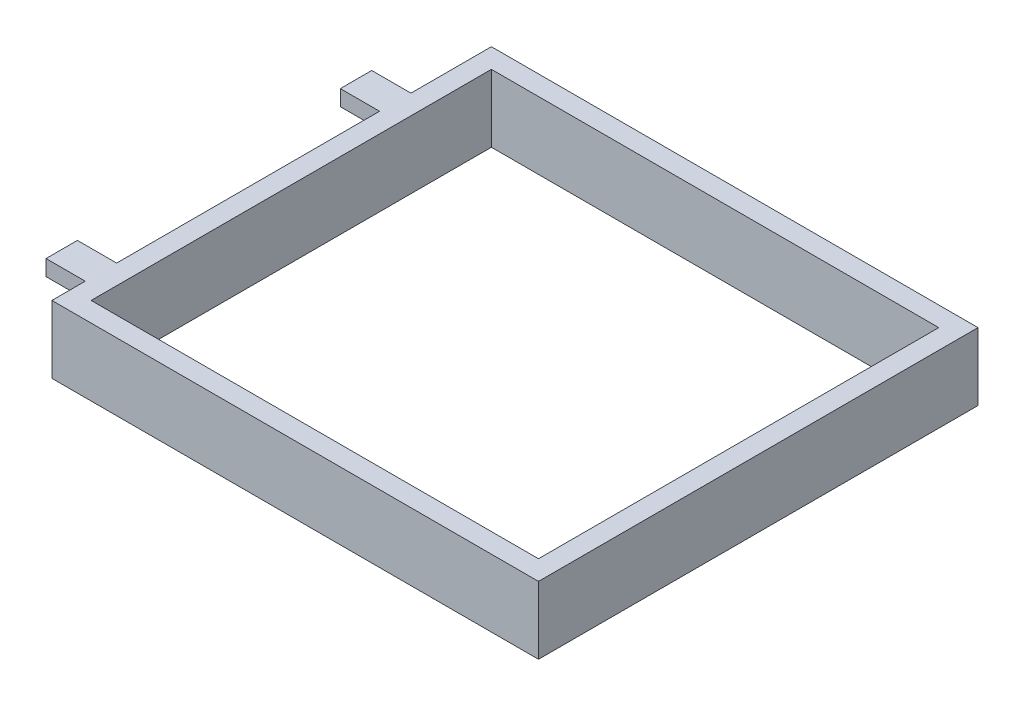
from build123d import *

# Parameters (mm, degrees)
SKETCH1_W           = 310
SKETCH1_H           = 280
SKETCH1_W_2         = 285
SKETCH1_H_2         = 255
BOSS_EXTRUDE1_DEPTH = 43
SKETCH2_W           = 20
SKETCH2_H           = 10
BOSS_EXTRUDE2_DEPTH = 25


with BuildPart() as part:
    # Sketch1 → Boss-Extrude1 (new body)
    with BuildSketch(Plane(origin=(0, 0, 0), x_dir=(1, 0, 0), z_dir=(0, 1, 0))):
        with Locations((155, 140)):
            Rectangle(SKETCH1_W, SKETCH1_H)
        with Locations((155, 140)):
            Rectangle(SKETCH1_W_2, SKETCH1_H_2, mode=Mode.SUBTRACT)
    extrude(amount=BOSS_EXTRUDE1_DEPTH)

    # Sketch2 → Boss-Extrude2 (add)
    with BuildSketch(Plane.ZY):
        with Locations((-218.75, 38)):
            Rectangle(SKETCH2_W, SKETCH2_H)
        with Locations((-31.25, 38)):
            Rectangle(SKETCH2_W, SKETCH2_H)
    extrude(amount=BOSS_EXTRUDE2_DEPTH)


solid = part.part
